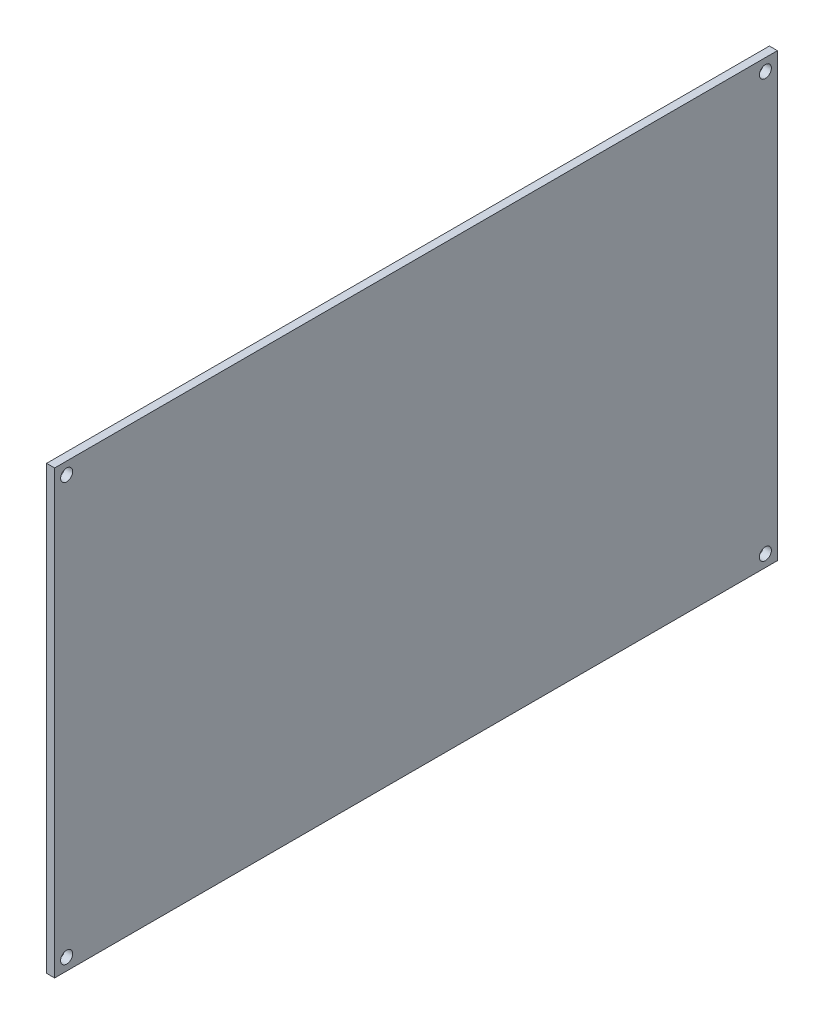
from build123d import *

# Parameters (mm, degrees)
SKETCH1_W           = 180
SKETCH1_H           = 110
BOSS_EXTRUDE1_DEPTH = 2
SKETCH2_R           = 1.5
CUT_EXTRUDE1_DEPTH  = 3


with BuildPart() as part:
    # Sketch1 → Boss-Extrude1 (new body)
    with BuildSketch(Plane(origin=(0, 0, 0), x_dir=(0, 0, -1), z_dir=(1, 0, 0))):
        with Locations((90, 55)):
            Rectangle(SKETCH1_W, SKETCH1_H)
    extrude(amount=BOSS_EXTRUDE1_DEPTH)

    # Sketch2 → Cut-Extrude1 (cut)
    with BuildSketch(Plane(origin=(2, 0, 0), x_dir=(0, 0, -1), z_dir=(1, 0, 0))):
        with Locations((3, 107)):
            Circle(SKETCH2_R)
        with Locations((177, 107)):
            Circle(SKETCH2_R)
        with Locations((177, 3)):
            Circle(SKETCH2_R)
        with Locations((3, 3)):
            Circle(SKETCH2_R)
    extrude(amount=-CUT_EXTRUDE1_DEPTH, mode=Mode.SUBTRACT)


solid = part.part
